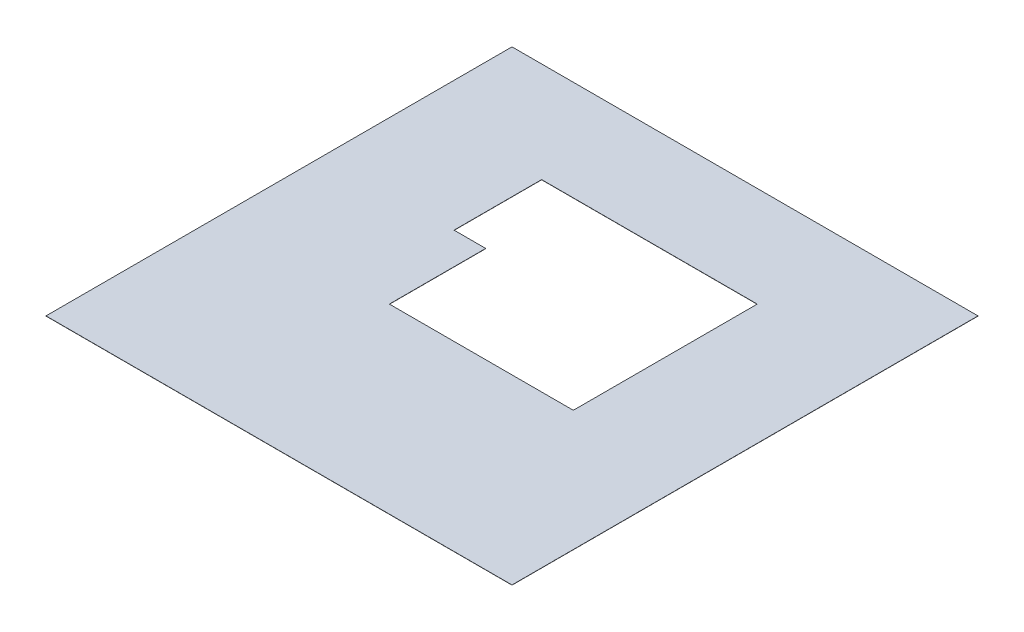
from build123d import *

# Parameters (mm, degrees)
SKETCH1_W           = 22800
SKETCH1_H           = 22800
BOSS_EXTRUDE1_DEPTH = 10


with BuildPart() as part:
    # Sketch1 → Boss-Extrude1 (new body)
    with BuildSketch(Plane(origin=(0, 0, 0), x_dir=(1, 0, 0), z_dir=(0, 1, 0))):
        Rectangle(SKETCH1_W, SKETCH1_H)
        Polygon((-3500, -2500), (5500, -2500), (5500, 6500), (-5050, 6500), (-5050, 2215), (-3500, 2215), align=None, mode=Mode.SUBTRACT)
    extrude(amount=BOSS_EXTRUDE1_DEPTH)


solid = part.part
